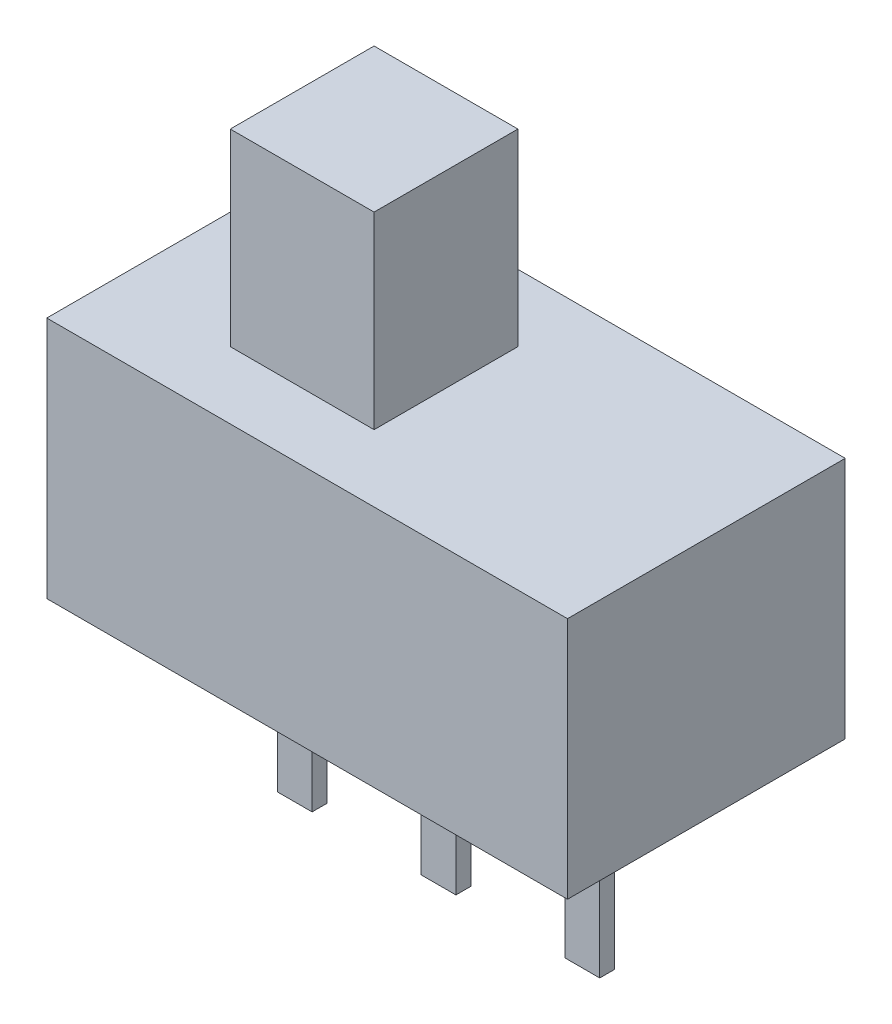
from build123d import *

# Parameters (mm, degrees)
ESQUISSE1_W        = 10.5
ESQUISSE1_H        = 5.6
BOSS_EXTRU_1_DEPTH = 4.9
ESQUISSE2_W        = 2.9
ESQUISSE2_H        = 2.9
BOSS_EXTRU_2_DEPTH = 3.8
ESQUISSE3_W        = 0.7
ESQUISSE3_H        = 0.3
BOSS_EXTRU_3_DEPTH = 3.7


with BuildPart() as part:
    # Esquisse1 → Boss.-Extru.1 (new body)
    with BuildSketch(Plane(origin=(0, 0, 0), x_dir=(1, 0, 0), z_dir=(0, 1, 0))):
        Rectangle(ESQUISSE1_W, ESQUISSE1_H)
    extrude(amount=BOSS_EXTRU_1_DEPTH)

    # Esquisse2 → Boss.-Extru.2 (add)
    with BuildSketch(Plane(origin=(0, 4.9, 0), x_dir=(1, 0, 0), z_dir=(0, 1, 0))):
        with Locations((-1.45, 0)):
            Rectangle(ESQUISSE2_W, ESQUISSE2_H)
    extrude(amount=BOSS_EXTRU_2_DEPTH)

    # Esquisse3 → Boss.-Extru.3 (add)
    with BuildSketch(Plane.XZ):
        Rectangle(ESQUISSE3_W, ESQUISSE3_H)
        with Locations((2.9, 0)):
            Rectangle(ESQUISSE3_W, ESQUISSE3_H)
        with Locations((-2.9, 0)):
            Rectangle(ESQUISSE3_W, ESQUISSE3_H)
    extrude(amount=BOSS_EXTRU_3_DEPTH)


solid = part.part
